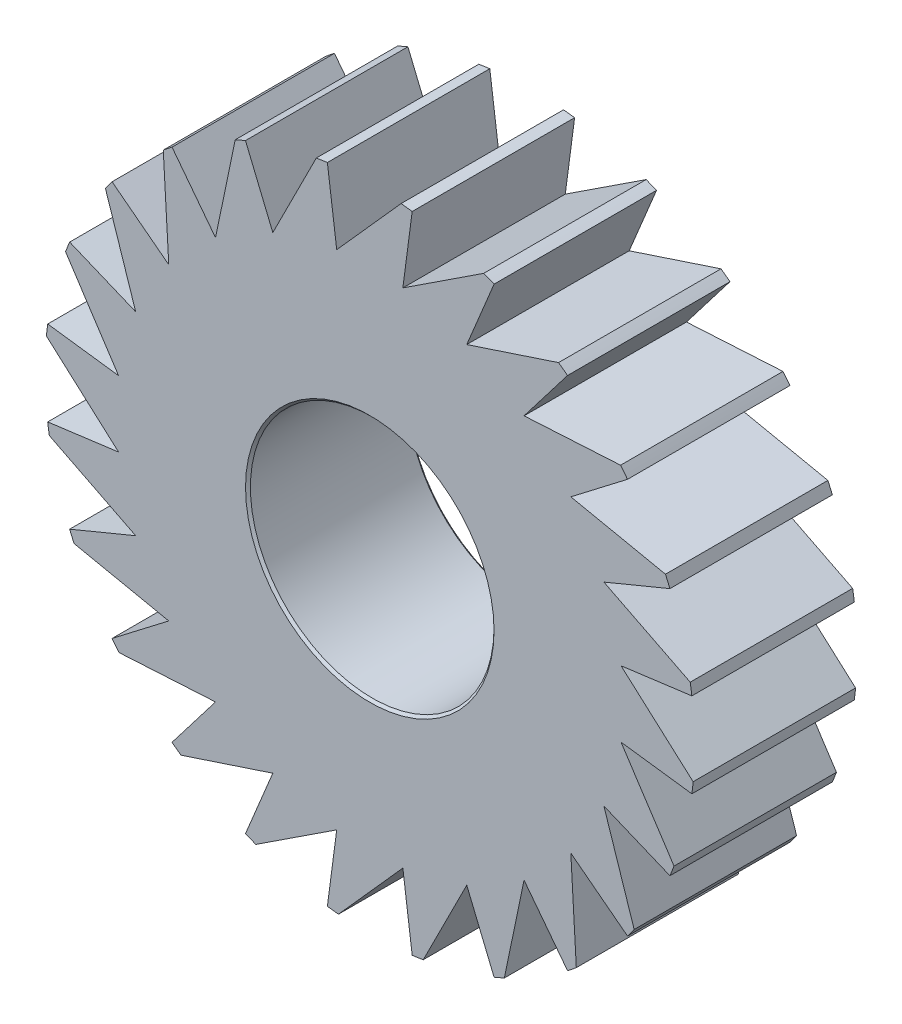
from build123d import *

# Parameters (mm, degrees)
SKETCH1_R               = 9.906
SKETCH1_R_2             = 4.7625
BOSS_EXTRUDE1_DEPTH     = 6.35
BOSS_EXTRUDE2_DEPTH     = 6.35
CIRPATTERN1_COUNT       = 24
CHAMFER1_SIZE           = 0.09525
SKETCH3_R               = 317.5
SKETCH3_R_2             = 12.7
CUT_EXTRUDE_THIN1_DEPTH = 20.746083273


with BuildPart() as part:
    # Sketch1 → Boss-Extrude1 (new body)
    with BuildSketch(Plane.XY):
        Circle(SKETCH1_R)
        Circle(SKETCH1_R_2, mode=Mode.SUBTRACT)
    extrude(amount=-BOSS_EXTRUDE1_DEPTH)

    # Sketch2 → Boss-Extrude2 (add)
    with BuildSketch(Plane.XY):
        with BuildLine():
            Line((-1.29299246, 9.821252797), (1.740566773, 13.220917226))
            Line((1.740566773, 13.220917226), (1.29299246, 9.821252797))
            ThreePointArc((1.29299246, 9.821252797), (0, 9.906), (-1.29299246, 9.821252797))
        make_face()
    boss_extrude2 = extrude(amount=-BOSS_EXTRUDE2_DEPTH)

    # CirPattern1: Boss-Extrude2 ×24 about axis
    cirpattern1_axis = Axis((0, 0, 0), (0, 0, 1))
    for i in range(1, CIRPATTERN1_COUNT):
        add(boss_extrude2.rotate(cirpattern1_axis, i * 360 / CIRPATTERN1_COUNT))

    # Chamfer1
    chamfer1_edges = [part.edges().sort_by_distance(p)[0] for p in [
        (-4.7625, 0, -6.35),
        (-4.7625, 0, 0),
    ]]
    chamfer(chamfer1_edges, length=CHAMFER1_SIZE)

    # Sketch3 → Cut-Extrude-Thin1 (cut, through all)
    with BuildSketch(Plane.XY):
        Circle(SKETCH3_R)
        Circle(SKETCH3_R_2, mode=Mode.SUBTRACT)
    extrude(amount=-CUT_EXTRUDE_THIN1_DEPTH, mode=Mode.SUBTRACT)


solid = part.part
